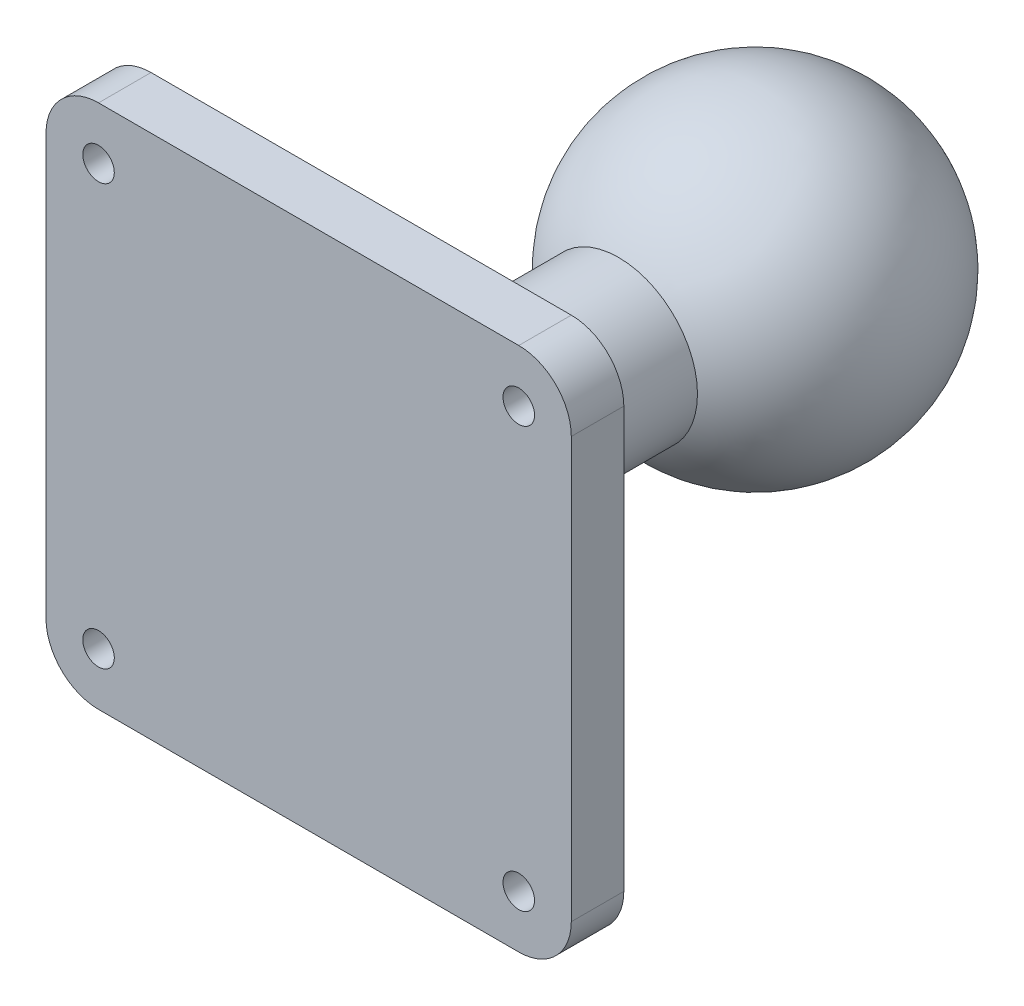
from build123d import *

# Parameters (mm, degrees)
CROQUIS1_W                   = 50
CROQUIS1_H                   = 50
SALIENTE_EXTRUIR1_DEPTH      = 5
SALIENTE_EXTRUIR2_REACH      = 65.295
SALIENTE_EXTRUIR2_END_RADIUS = 15
CROQUIS2_R                   = 7.5
CROQUIS4_R                   = 1.5
CORTAR_EXTRUIR1_DEPTH        = 5
REDONDEO1_R                  = 5
REDONDEO2_R                  = 5


with BuildPart() as part:
    # Croquis1 → Saliente-Extruir1 (new body)
    with BuildSketch(Plane.XY):
        Rectangle(CROQUIS1_W, CROQUIS1_H)
    extrude(amount=SALIENTE_EXTRUIR1_DEPTH)



with BuildPart() as body_2:
    # Croquis3 → Revolución1 (revolve)
    with BuildSketch(Plane(origin=(0, 0, -37.5), x_dir=(-1, 0, 0), z_dir=(0, 0, -1))):
        with BuildLine():
            Line((0, 15), (0, -15))
            ThreePointArc((0, -15), (15, 0), (0, 15))
        make_face()
    revolve(axis=Axis((0, 15, -37.5), (0, -1, 0)))


with BuildPart() as part_1:
    add(part.part)

    add(body_2.part)  # Saliente-Extruir2 merges body 2
    # Saliente-Extruir2: up to this sphere (the profile starts outside it)
    saliente_extruir2_end = Location((0, 0, -37.5)) * Sphere(SALIENTE_EXTRUIR2_END_RADIUS, mode=Mode.PRIVATE)
    # Croquis2 → Saliente-Extruir2 (add, up to the surface)
    with BuildSketch(Plane(origin=(0, 0, 0), x_dir=(-1, 0, 0), z_dir=(0, 0, -1)), mode=Mode.PRIVATE) as saliente_extruir2_sk1:
        with Locations(Location((0, 0, 0), (0, 0, 180))):
            Circle(CROQUIS2_R)
    saliente_extruir2_tool1 = extrude(saliente_extruir2_sk1.sketch, amount=SALIENTE_EXTRUIR2_REACH, mode=Mode.PRIVATE) - saliente_extruir2_end
    add(saliente_extruir2_tool1.solids().sort_by_distance((0, 0, 0))[0])

    # Croquis4 → Cortar-Extruir1 (cut)
    with BuildSketch(Plane(origin=(0, 0, 0), x_dir=(-1, 0, 0), z_dir=(0, 0, -1))):
        with Locations((-20, 20)):
            Circle(CROQUIS4_R)
        with Locations(Location((20, 20, 0), (0, 0, 180))):
            Circle(CROQUIS4_R)
        with Locations((20, -20)):
            Circle(CROQUIS4_R)
        with Locations(Location((-20, -20, 0), (0, 0, 180))):
            Circle(CROQUIS4_R)
    extrude(amount=-CORTAR_EXTRUIR1_DEPTH, mode=Mode.SUBTRACT)

    # Redondeo1
    redondeo1_edges = [part_1.edges().sort_by_distance(p)[0] for p in [
        (25, -25, 2.5),
        (-25, -25, 2.5),
        (-25, 25, 2.5),
        (25, 25, 2.5),
    ]]
    fillet(redondeo1_edges, radius=REDONDEO1_R)

    # Redondeo2
    redondeo2_edges = [part_1.edges().sort_by_distance(p)[0] for p in [
        (-7.5, 0, 0),
    ]]
    fillet(redondeo2_edges, radius=REDONDEO2_R)


solid = part_1.part
